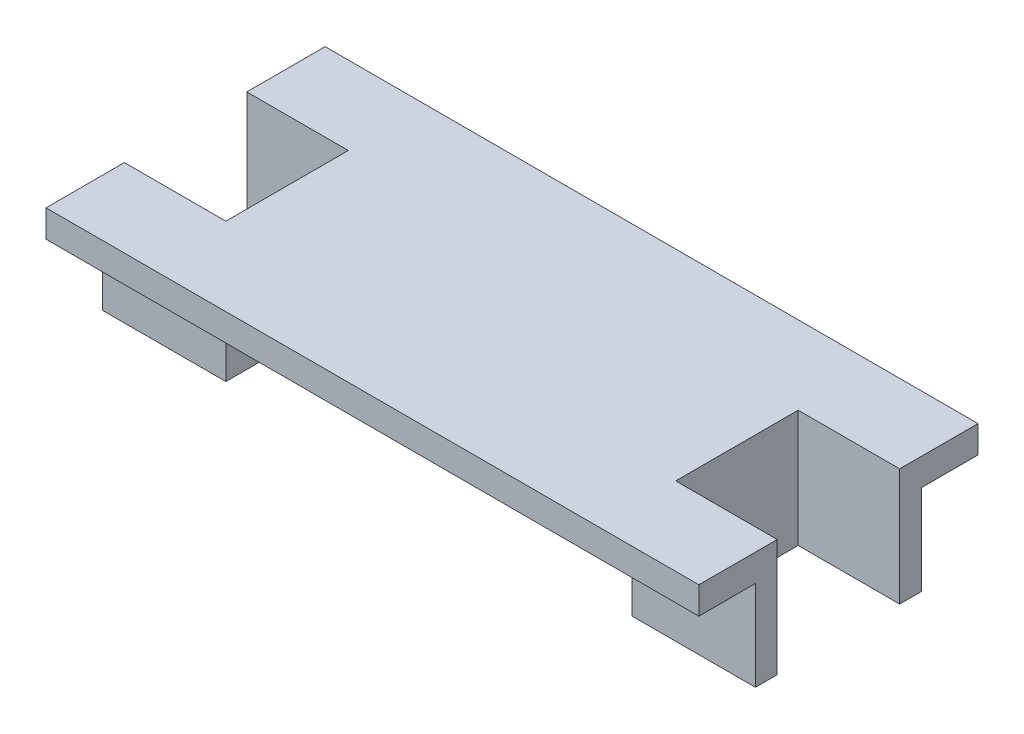
from build123d import *

# Parameters (mm, degrees)
BOSS_EXTRUDE1_DEPTH = 5
BOSS_EXTRUDE2_DEPTH = 16.532


with BuildPart() as part:
    # Sketch1 → Boss-Extrude1 (new body)
    with BuildSketch(Plane(origin=(0, 0, 0), x_dir=(1, 0, 0), z_dir=(0, 1, 0))):
        Polygon((-60, 25.6535), (-60, 11.24975), (-41.343, 11.24975), (-41.343, -11.24975), (-60, -11.24975), (-60, -25.6535), (60, -25.6535), (60, -11.2535), (41.343, -11.2535), (41.343, 11.2535), (60, 11.2535), (60, 25.6535), align=None)
    extrude(amount=BOSS_EXTRUDE1_DEPTH)

    # Sketch2 → Boss-Extrude2 (add)
    with BuildSketch(Plane.XZ):
        Polygon((60, 15.2535), (37.343, 15.2535), (37.343, -15.2535), (60, -15.2535), (60, -11.2535), (41.343, -11.2535), (41.343, 11.2535), (60, 11.2535), align=None)
        Polygon((-60, 11.24975), (-60, 15.24975), (-37.343, 15.24975), (-37.343, -15.2535), (-60, -15.2535), (-60, -11.24975), (-41.343, -11.24975), (-41.343, 11.24975), align=None)
    extrude(amount=BOSS_EXTRUDE2_DEPTH)


solid = part.part
